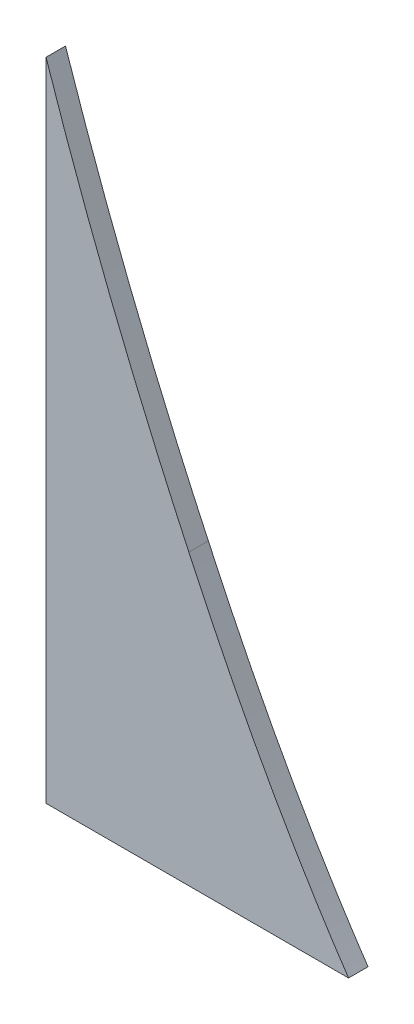
from build123d import *

# Parameters (mm, degrees)
BOSS_EXTRUDE1_DEPTH = 2


with BuildPart() as part:
    # Sketch1 → Boss-Extrude1 (new body)
    with BuildSketch(Plane.XY):
        with BuildLine():
            Line((4.776123669, 90.059935933), (4.776123669, 23.645107557))
            Line((4.776123669, 23.645107557), (35.871812629, 23.645107557))
            add(Edge.make_bspline(
                [(19.461908342, 53.345474249), (27.31363262, 36.323892756), (35.871812629, 23.645107557)],
                knots=[0, 0, 0, 1, 1, 1], degree=2))
            add(Edge.make_bspline(
                [(4.776123669, 90.059935933), (11.042468272, 71.357555054), (19.461908342, 53.345474249)],
                knots=[0, 0, 0, 1, 1, 1], degree=2))
        make_face()
    extrude(amount=BOSS_EXTRUDE1_DEPTH)


solid = part.part
